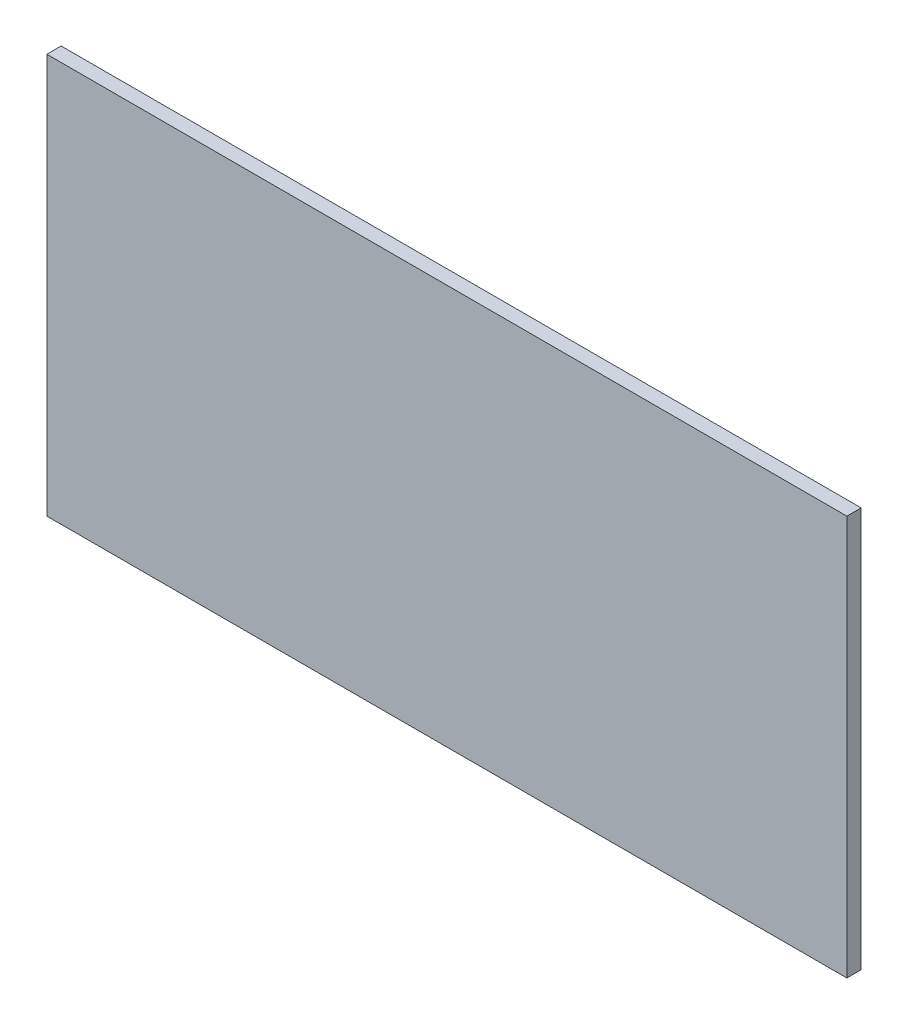
from build123d import *

# Parameters (mm, degrees)
SKETCH2_W           = 1400
SKETCH2_H           = 700
BOSS_EXTRUDE1_DEPTH = 25


with BuildPart() as part:
    # Sketch2 → Boss-Extrude1 (new body)
    with BuildSketch(Plane.XY):
        with Locations((700, 350)):
            Rectangle(SKETCH2_W, SKETCH2_H)
    extrude(amount=BOSS_EXTRUDE1_DEPTH)


solid = part.part
